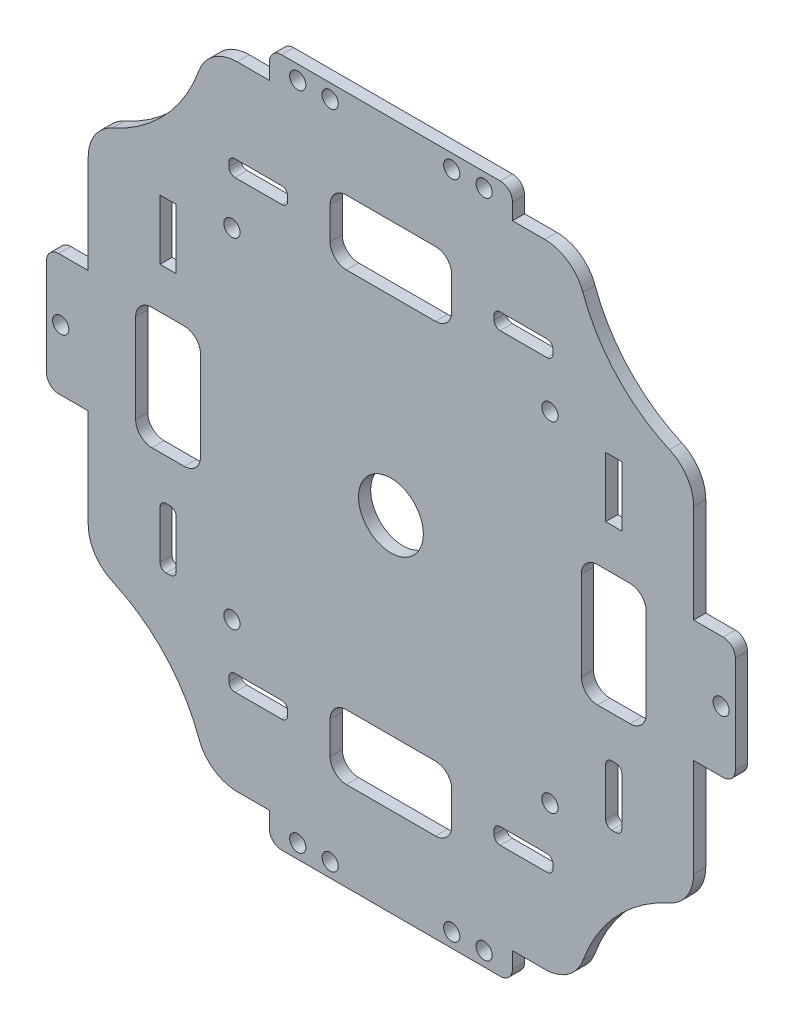
from build123d import *

# Parameters (mm, degrees)
BOSS_EXTRUDE1_DEPTH = 3
SKETCH2_R           = 8
CUT_EXTRUDE2_DEPTH  = 5
SKETCH3_R           = 2
CUT_EXTRUDE3_DEPTH  = 5
SKETCH4_R           = 2
CUT_EXTRUDE4_DEPTH  = 5
SKETCH5_R           = 2
SKETCH5_W           = 4
SKETCH5_H           = 14.81305052
CUT_EXTRUDE5_DEPTH  = 5


with BuildPart() as part:
    # Sketch1 → Boss-Extrude1 (new body)
    with BuildSketch(Plane.XY):
        with BuildLine():
            Line((82, 15), (74.70882917, 15))
            Line((74.70882917, 15), (74.70882917, 39.302424721))
            ThreePointArc((74.70882917, 39.302424721), (73.092812163, 44.753005348), (68.767063336, 48.441939777))
            ThreePointArc((68.767063336, 48.441939777), (55.730177295, 57.736884279), (47.382982574, 71.4))
            ThreePointArc((47.382982574, 71.4), (43.723290865, 76.185352772), (37.978728218, 78))
            Line((37.978728218, 78), (30, 78))
            Line((30, 78), (30, 82))
            ThreePointArc((30, 82), (29.121320344, 84.121320344), (27, 85))
            Line((27, 85), (-27, 85))
            ThreePointArc((-27, 85), (-29.121320344, 84.121320344), (-30, 82))
            Line((-30, 82), (-30, 78))
            Line((-30, 78), (-37.978728218, 78))
            ThreePointArc((-37.978728218, 78), (-43.723290865, 76.185352772), (-47.382982574, 71.4))
            ThreePointArc((-47.382982574, 71.4), (-55.730177295, 57.736884279), (-68.767063336, 48.441939777))
            ThreePointArc((-68.767063336, 48.441939777), (-73.092812163, 44.753005348), (-74.70882917, 39.302424721))
            Line((-74.70882917, 39.302424721), (-74.70882917, 15))
            Line((-74.70882917, 15), (-82, 15))
            ThreePointArc((-82, 15), (-84.121320344, 14.121320344), (-85, 12))
            Line((-85, 12), (-85, -12))
            ThreePointArc((-85, -12), (-84.121320344, -14.121320344), (-82, -15))
            Line((-82, -15), (-74.70882917, -15))
            Line((-74.70882917, -15), (-74.70882917, -39.302424721))
            ThreePointArc((-74.70882917, -39.302424721), (-73.092812163, -44.753005348), (-68.767063336, -48.441939777))
            ThreePointArc((-68.767063336, -48.441939777), (-55.730177295, -57.736884279), (-47.382982574, -71.4))
            ThreePointArc((-47.382982574, -71.4), (-43.723290865, -76.185352772), (-37.978728218, -78))
            Line((-37.978728218, -78), (-30, -78))
            Line((-30, -78), (-30, -82))
            ThreePointArc((-30, -82), (-29.121320344, -84.121320344), (-27, -85))
            Line((-27, -85), (27, -85))
            ThreePointArc((27, -85), (29.121320344, -84.121320344), (30, -82))
            Line((30, -82), (30, -78))
            Line((30, -78), (37.978728218, -78))
            ThreePointArc((37.978728218, -78), (43.723290865, -76.185352772), (47.382982574, -71.4))
            ThreePointArc((47.382982574, -71.4), (55.730177295, -57.736884279), (68.767063336, -48.441939777))
            ThreePointArc((68.767063336, -48.441939777), (73.092812163, -44.753005348), (74.70882917, -39.302424721))
            Line((74.70882917, -39.302424721), (74.70882917, -15))
            Line((74.70882917, -15), (82, -15))
            ThreePointArc((82, -15), (84.121320344, -14.121320344), (85, -12))
            Line((85, -12), (85, 12))
            ThreePointArc((85, 12), (84.121320344, 14.121320344), (82, 15))
        make_face()
    extrude(amount=-BOSS_EXTRUDE1_DEPTH)

    # Sketch2 → Cut-Extrude2 (cut)
    with BuildSketch(Plane.XY):
        Circle(SKETCH2_R)
    extrude(amount=-CUT_EXTRUDE2_DEPTH, mode=Mode.SUBTRACT)

    # Sketch3 → Cut-Extrude3 (cut)
    with BuildSketch(Plane.XY):
        with Locations((81.5, 0)):
            Circle(SKETCH3_R)
        with Locations((-81.5, 0)):
            Circle(SKETCH3_R)
    extrude(amount=-CUT_EXTRUDE3_DEPTH, mode=Mode.SUBTRACT)

    # Sketch4 → Cut-Extrude4 (cut)
    with BuildSketch(Plane.XY):
        with Locations((23, 81.5)):
            Circle(SKETCH4_R)
        with Locations((15, 81.5)):
            Circle(SKETCH4_R)
        with Locations((-15, 81.5)):
            Circle(SKETCH4_R)
        with Locations((-23, 81.5)):
            Circle(SKETCH4_R)
        with Locations((-23, -81.5)):
            Circle(SKETCH4_R)
        with Locations((-15, -81.5)):
            Circle(SKETCH4_R)
        with Locations((15, -81.5)):
            Circle(SKETCH4_R)
        with Locations((23, -81.5)):
            Circle(SKETCH4_R)
    extrude(amount=-CUT_EXTRUDE4_DEPTH, mode=Mode.SUBTRACT)

    # Sketch5 → Cut-Extrude5 (cut)
    with BuildSketch(Plane.XY):
        with Locations((39.243, 41.859)):
            Circle(SKETCH5_R)
        with Locations((39.243, -41.859)):
            Circle(SKETCH5_R)
        with Locations((-39.243, -41.859)):
            Circle(SKETCH5_R)
        with Locations((-39.243, 41.859)):
            Circle(SKETCH5_R)
        with BuildLine():
            Line((-15, -59), (-15, -51))
            ThreePointArc((-15, -51), (-13.828427125, -48.171572875), (-11, -47))
            Line((-11, -47), (11, -47))
            ThreePointArc((11, -47), (13.828427125, -48.171572875), (15, -51))
            Line((15, -51), (15, -59))
            ThreePointArc((15, -59), (13.828427125, -61.828427125), (11, -63))
            Line((11, -63), (-11, -63))
            ThreePointArc((-11, -63), (-13.828427125, -61.828427125), (-15, -59))
        make_face()
        with BuildLine():
            Line((51, 15), (59, 15))
            ThreePointArc((59, 15), (61.828427125, 13.828427125), (63, 11))
            Line((63, 11), (63, -11))
            ThreePointArc((63, -11), (61.828427125, -13.828427125), (59, -15))
            Line((59, -15), (51, -15))
            ThreePointArc((51, -15), (48.171572875, -13.828427125), (47, -11))
            Line((47, -11), (47, 11))
            ThreePointArc((47, 11), (48.171572875, 13.828427125), (51, 15))
        make_face()
        with BuildLine():
            Line((-63, 11), (-63, -11))
            ThreePointArc((-63, -11), (-61.828427125, -13.828427125), (-59, -15))
            Line((-59, -15), (-51, -15))
            ThreePointArc((-51, -15), (-48.171572875, -13.828427125), (-47, -11))
            Line((-47, -11), (-47, 11))
            ThreePointArc((-47, 11), (-48.171572875, 13.828427125), (-51, 15))
            Line((-51, 15), (-59, 15))
            ThreePointArc((-59, 15), (-61.828427125, 13.828427125), (-63, 11))
        make_face()
        with BuildLine():
            Line((-11, 63), (11, 63))
            ThreePointArc((11, 63), (13.828427125, 61.828427125), (15, 59))
            Line((15, 59), (15, 51))
            ThreePointArc((15, 51), (13.828427125, 48.171572875), (11, 47))
            Line((11, 47), (-11, 47))
            ThreePointArc((-11, 47), (-13.828427125, 48.171572875), (-15, 51))
            Line((-15, 51), (-15, 59))
            ThreePointArc((-15, 59), (-13.828427125, 61.828427125), (-11, 63))
        make_face()
        with BuildLine():
            Line((-26.967278586, -57), (-38.5, -57))
            ThreePointArc((-38.5, -57), (-39.560660172, -56.560660172), (-40, -55.5))
            Line((-40, -55.5), (-40, -54.5))
            ThreePointArc((-40, -54.5), (-39.560660172, -53.439339828), (-38.5, -53))
            Line((-38.5, -53), (-26.967278586, -53))
            ThreePointArc((-26.967278586, -53), (-25.906618414, -53.439339828), (-25.467278586, -54.5))
            Line((-25.467278586, -54.5), (-25.467278586, -55.5))
            ThreePointArc((-25.467278586, -55.5), (-25.906618414, -56.560660172), (-26.967278586, -57))
        make_face()
        with Locations((55, 32.59347474)):
            Rectangle(SKETCH5_W, SKETCH5_H)
        with Locations((-55, 32.59347474)):
            Rectangle(SKETCH5_W, SKETCH5_H)
        with BuildLine():
            Line((55.5, -25.18694948), (54.5, -25.18694948))
            ThreePointArc((54.5, -25.18694948), (53.439339828, -25.626289308), (53, -26.68694948))
            Line((53, -26.68694948), (53, -38.5))
            ThreePointArc((53, -38.5), (53.439339828, -39.560660172), (54.5, -40))
            Line((54.5, -40), (55.5, -40))
            ThreePointArc((55.5, -40), (56.560660172, -39.560660172), (57, -38.5))
            Line((57, -38.5), (57, -26.68694948))
            ThreePointArc((57, -26.68694948), (56.560660172, -25.626289308), (55.5, -25.18694948))
        make_face()
        with BuildLine():
            Line((-55.5, -40), (-54.5, -40))
            ThreePointArc((-54.5, -40), (-53.439339828, -39.560660172), (-53, -38.5))
            Line((-53, -38.5), (-53, -26.68694948))
            ThreePointArc((-53, -26.68694948), (-53.439339828, -25.626289308), (-54.5, -25.18694948))
            Line((-54.5, -25.18694948), (-55.5, -25.18694948))
            ThreePointArc((-55.5, -25.18694948), (-56.560660172, -25.626289308), (-57, -26.68694948))
            Line((-57, -26.68694948), (-57, -38.5))
            ThreePointArc((-57, -38.5), (-56.560660172, -39.560660172), (-55.5, -40))
        make_face()
        with BuildLine():
            Line((-25.467278586, 55.5), (-25.467278586, 54.5))
            ThreePointArc((-25.467278586, 54.5), (-25.906618414, 53.439339828), (-26.967278586, 53))
            Line((-26.967278586, 53), (-38.5, 53))
            ThreePointArc((-38.5, 53), (-39.560660172, 53.439339828), (-40, 54.5))
            Line((-40, 54.5), (-40, 55.5))
            ThreePointArc((-40, 55.5), (-39.560660172, 56.560660172), (-38.5, 57))
            Line((-38.5, 57), (-26.967278586, 57))
            ThreePointArc((-26.967278586, 57), (-25.906618414, 56.560660172), (-25.467278586, 55.5))
        make_face()
        with BuildLine():
            Line((26.967278586, 57), (38.5, 57))
            ThreePointArc((38.5, 57), (39.560660172, 56.560660172), (40, 55.5))
            Line((40, 55.5), (40, 54.5))
            ThreePointArc((40, 54.5), (39.560660172, 53.439339828), (38.5, 53))
            Line((38.5, 53), (26.967278586, 53))
            ThreePointArc((26.967278586, 53), (25.906618414, 53.439339828), (25.467278586, 54.5))
            Line((25.467278586, 54.5), (25.467278586, 55.5))
            ThreePointArc((25.467278586, 55.5), (25.906618414, 56.560660172), (26.967278586, 57))
        make_face()
        with BuildLine():
            Line((40, -55.5), (40, -54.5))
            ThreePointArc((40, -54.5), (39.560660172, -53.439339828), (38.5, -53))
            Line((38.5, -53), (26.967278586, -53))
            ThreePointArc((26.967278586, -53), (25.906618414, -53.439339828), (25.467278586, -54.5))
            Line((25.467278586, -54.5), (25.467278586, -55.5))
            ThreePointArc((25.467278586, -55.5), (25.906618414, -56.560660172), (26.967278586, -57))
            Line((26.967278586, -57), (38.5, -57))
            ThreePointArc((38.5, -57), (39.560660172, -56.560660172), (40, -55.5))
        make_face()
    extrude(amount=-CUT_EXTRUDE5_DEPTH, mode=Mode.SUBTRACT)


solid = part.part
